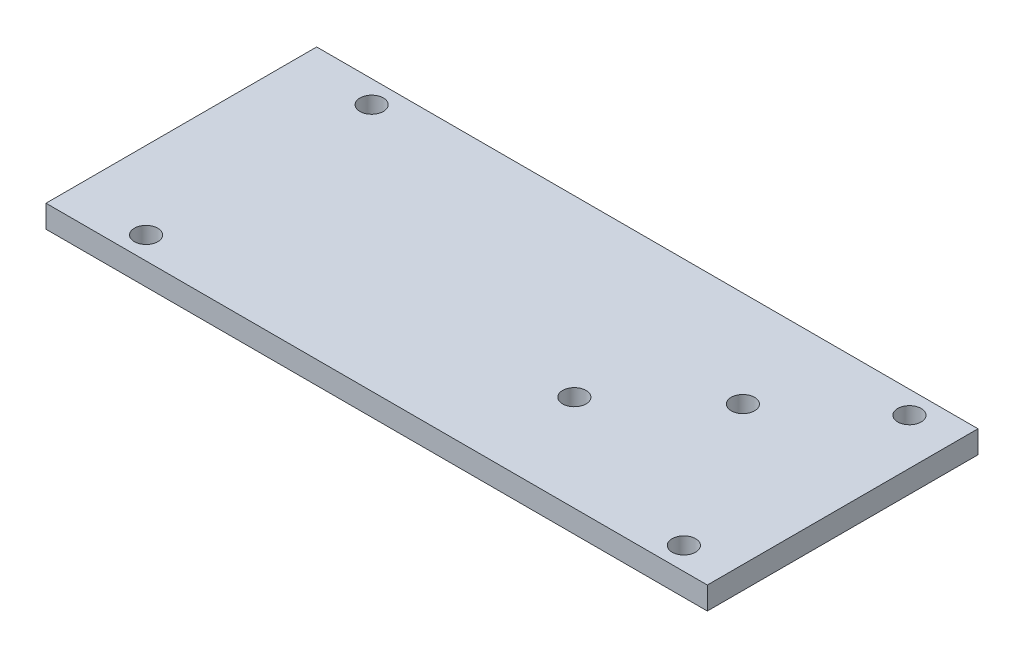
from build123d import *

# Parameters (mm, degrees)
SKETCH1_W           = 93.091
SKETCH1_H           = 38.1
SKETCH1_R           = 1.651
BOSS_EXTRUDE1_DEPTH = 3.175


with BuildPart() as part:
    # Sketch1 → Boss-Extrude1 (new body)
    with BuildSketch(Plane(origin=(0, 0, 0), x_dir=(1, 0, 0), z_dir=(0, 1, 0))):
        Rectangle(SKETCH1_W, SKETCH1_H)
        with Locations(Location((40.0685, 15.875, 0), (0, 0, 270))):
            Circle(SKETCH1_R, mode=Mode.SUBTRACT)
        with Locations(Location((40.0685, -15.875, 0), (0, 0, 270))):
            Circle(SKETCH1_R, mode=Mode.SUBTRACT)
        with Locations(Location((-35.631192741, -15.875, 0), (0, 0, 270))):
            Circle(SKETCH1_R, mode=Mode.SUBTRACT)
        with Locations(Location((-35.631192741, 15.875, 0), (0, 0, 270))):
            Circle(SKETCH1_R, mode=Mode.SUBTRACT)
        with Locations(Location((26.9875, 5.5118, 0), (0, 0, 270))):
            Circle(SKETCH1_R, mode=Mode.SUBTRACT)
        with Locations(Location((14.2875, -5.5118, 0), (0, 0, 270))):
            Circle(SKETCH1_R, mode=Mode.SUBTRACT)
    extrude(amount=BOSS_EXTRUDE1_DEPTH)


solid = part.part
